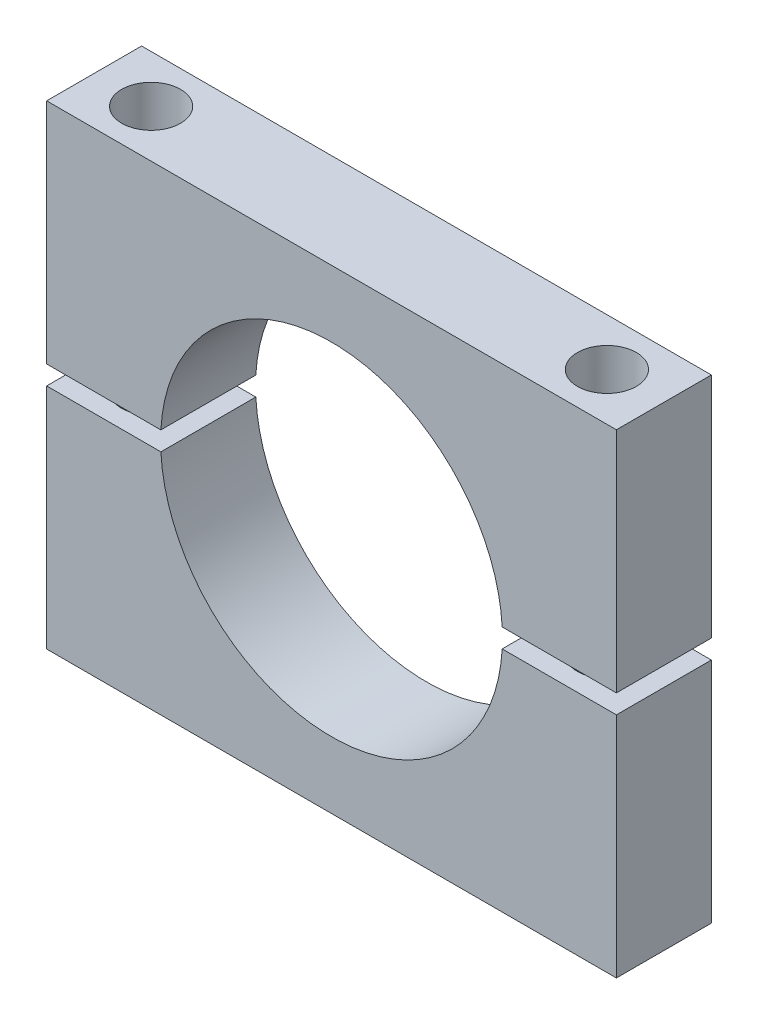
from build123d import *

# Parameters (mm, degrees)
SKETCH_1_W          = 30
SKETCH_1_H          = 5
EXTRUDE_1_DEPTH     = 25
CUT_EXTRUDE_1_DEPTH = 21
SKETCH_3_R          = 1.55
CUT_EXTRUDE_2_DEPTH = 41


with BuildPart() as part:
    # 草图1 → 凸台-拉伸1 (new body)
    with BuildSketch(Plane(origin=(0, 0, 0), x_dir=(1, 0, 0), z_dir=(0, 1, 0))):
        Rectangle(SKETCH_1_W, SKETCH_1_H)
    extrude(amount=EXTRUDE_1_DEPTH)

    # 草图2 → 切除-拉伸1 (cut)
    with BuildSketch(Plane.XY.offset(2.5)):
        with BuildLine():
            Line((-15, 12), (-8.986100378, 12))
            ThreePointArc((-8.986100378, 12), (0, 3.5), (8.986100378, 12))
            Line((8.986100378, 12), (15, 12))
            Line((15, 12), (15, 13))
            Line((15, 13), (8.986100378, 13))
            ThreePointArc((8.986100378, 13), (0, 21.5), (-8.986100378, 13))
            Line((-8.986100378, 13), (-15, 13))
            Line((-15, 13), (-15, 12))
        make_face()
    extrude(amount=-CUT_EXTRUDE_1_DEPTH, mode=Mode.SUBTRACT)


with BuildPart() as cut_extrude_1_piece_1:
    # of the separate pieces the step leaves, piece 1, a body of its own (cut_extrude_1_pieces)
    add(part.part.solids().sort_by_distance((15, 0, 2.5))[0])


with BuildPart() as cut_extrude_1_piece_2:
    # of the separate pieces the step leaves, piece 2, a body of its own (cut_extrude_1_pieces)
    add(part.part.solids().sort_by_distance((15, 13, 2.5))[0])


with BuildPart() as cut_extrude_2_tool:
    # 草图3 → 切除-拉伸2 (new body)
    with BuildSketch(Plane(origin=(0, 25, 0), x_dir=(1, 0, 0), z_dir=(0, 1, 0))):
        with Locations(Location((-12, 0, 0), (0, 0, 270))):
            Circle(SKETCH_3_R)
        with Locations(Location((12, 0, 0), (0, 0, 270))):
            Circle(SKETCH_3_R)
    extrude(amount=-CUT_EXTRUDE_2_DEPTH)


with BuildPart() as cut_extrude_1_piece_1_1:
    add(cut_extrude_1_piece_1.part)

    # 切除-拉伸2: cut by cut_extrude_2_tool
    add(cut_extrude_2_tool.part, mode=Mode.SUBTRACT)


with BuildPart() as cut_extrude_1_piece_2_1:
    add(cut_extrude_1_piece_2.part)

    # 切除-拉伸2: cut by cut_extrude_2_tool
    add(cut_extrude_2_tool.part, mode=Mode.SUBTRACT)


solid = Compound([cut_extrude_1_piece_1_1.part, cut_extrude_1_piece_2_1.part])
